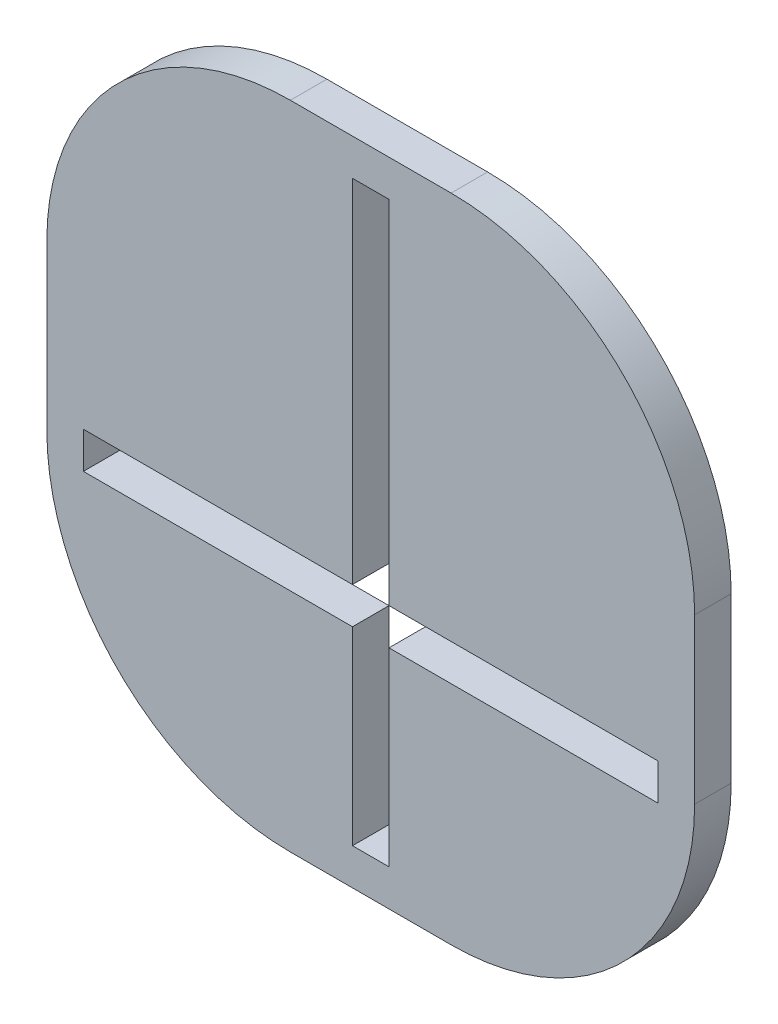
from build123d import *

# Parameters (mm, degrees)
SALIENTE_EXTRUIR1_DEPTH = 3


with BuildPart() as part:
    # Croquis1 → Saliente-Extruir1 (new body)
    with BuildSketch(Plane.XY):
        with BuildLine():
            Line((-6.6, -26.735), (6.6, -26.735))
            ThreePointArc((6.6, -26.735), (20.742135624, -20.877135624), (26.6, -6.735))
            Line((26.6, -6.735), (26.6, 6.735))
            ThreePointArc((26.6, 6.735), (20.742135624, 20.877135624), (6.6, 26.735))
            Line((6.6, 26.735), (-6.6, 26.735))
            ThreePointArc((-6.6, 26.735), (-20.742135624, 20.877135624), (-26.6, 6.735))
            Line((-26.6, 6.735), (-26.6, -6.735))
            ThreePointArc((-26.6, -6.735), (-20.742135624, -20.877135624), (-6.6, -26.735))
        make_face()
        Polygon((-23.6, -8.16), (-23.6, -5.16), (-1.5, -5.16), (-1.5, 23.735), (1.5, 23.735), (1.5, -5.16), (23.6, -5.16), (23.6, -8.16), (1.5, -8.16), (1.5, -23.735), (-1.5, -23.735), (-1.5, -8.16), align=None, mode=Mode.SUBTRACT)
    extrude(amount=SALIENTE_EXTRUIR1_DEPTH)


solid = part.part
